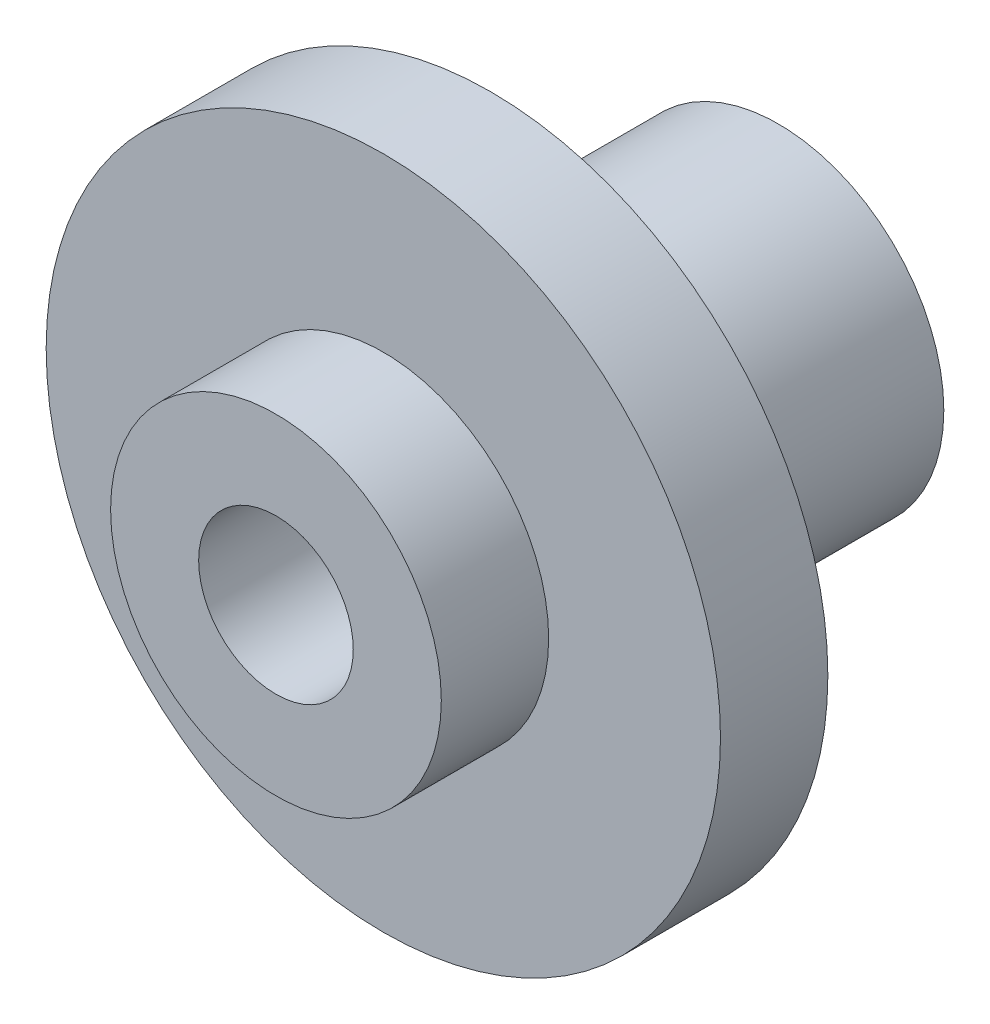
from build123d import *

# Parameters (mm, degrees)
SKETCH1_R           = 3.9878
BOSS_EXTRUDE1_DEPTH = 1.27
SKETCH2_R           = 1.9558
SKETCH2_R_2         = 0.9144
BOSS_EXTRUDE2_DEPTH = 1.27
BOSS_EXTRUDE3_START = 3.4036
SKETCH3_R           = 1.9558
BOSS_EXTRUDE3_DEPTH = 3.4036
SKETCH4_R           = 0.9144
CUT_EXTRUDE1_DEPTH  = 9.193380172


with BuildPart() as part:
    # Sketch1 → Boss-Extrude1 (new body)
    with BuildSketch(Plane.XY):
        Circle(SKETCH1_R)
    extrude(amount=BOSS_EXTRUDE1_DEPTH)

    # Sketch2 → Boss-Extrude2 (add)
    with BuildSketch(Plane.XY.offset(1.27)):
        Circle(SKETCH2_R)
        Circle(SKETCH2_R_2, mode=Mode.SUBTRACT)
    extrude(amount=BOSS_EXTRUDE2_DEPTH)

    # Sketch3 → Boss-Extrude3 (add)
    with BuildSketch(Plane(origin=(0, 0, 0), x_dir=(-1, 0, 0), z_dir=(0, 0, -1)).offset(BOSS_EXTRUDE3_START)):
        with Locations(Location((0, 0, 0), (0, 0, 180))):
            Circle(SKETCH3_R)
    extrude(amount=-BOSS_EXTRUDE3_DEPTH)

    # Sketch4 → Cut-Extrude1 (cut, through all)
    with BuildSketch(Plane(origin=(0, 0, -3.4036), x_dir=(-1, 0, 0), z_dir=(0, 0, -1))):
        Circle(SKETCH4_R)
    extrude(amount=-CUT_EXTRUDE1_DEPTH, mode=Mode.SUBTRACT)


solid = part.part
